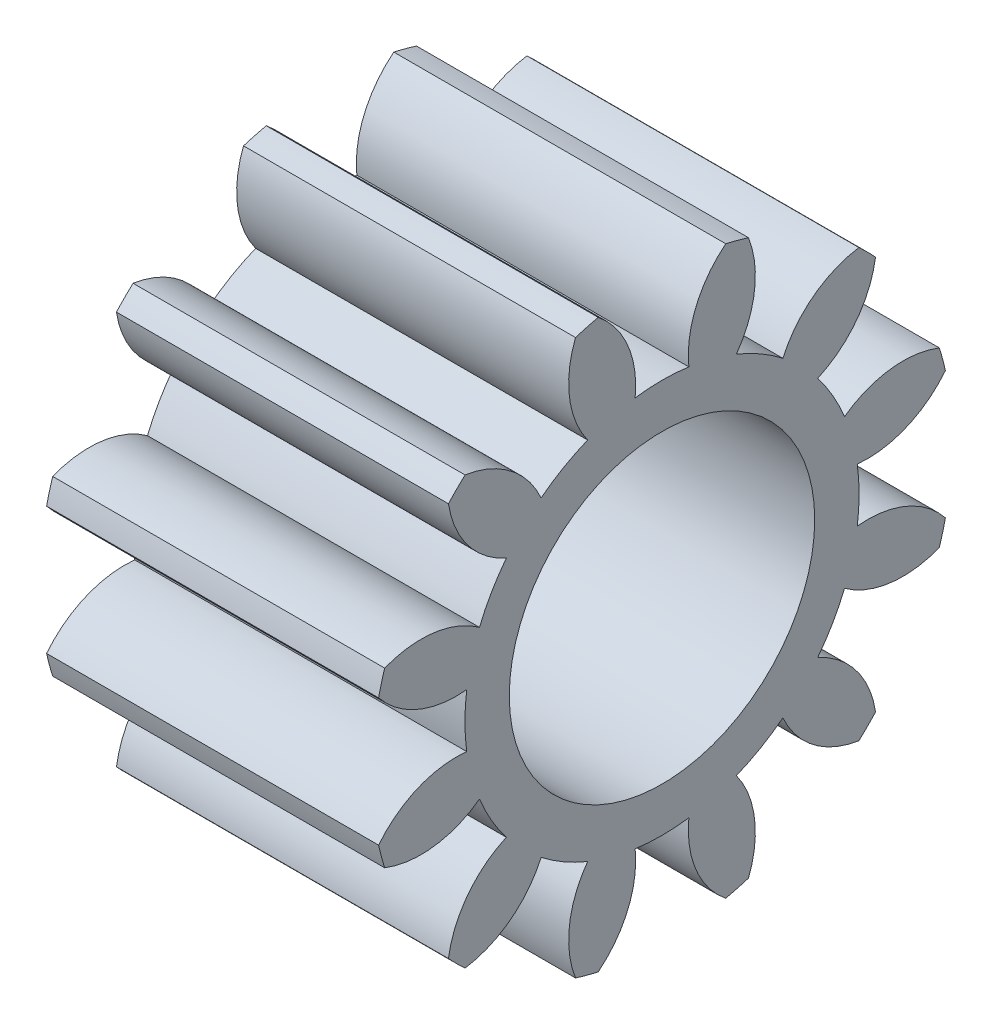
from build123d import *

# Parameters (mm, degrees)
BASPROSKE_W        = 12.7
BASPROSKE_H        = 11.1125
TOOTHCUT_DEPTH     = 21.205576272
TEETHCUTS_COUNT    = 12
TEETHCUTS_ANGLE    = 330
BORSKE_R           = 3.175
BORE_DEPTH         = 50.8000508
SKETCH2_R          = 5.842
CUT_EXTRUDE1_DEPTH = 20.908878764


with BuildPart() as part:
    # BasProSke → Base-Revolve (revolve)
    with BuildSketch(Plane(origin=(0, 0, 0), x_dir=(1, 0, 0), z_dir=(0, 1, 0)), mode=Mode.PRIVATE) as base_revolve_sk:
        with Locations((6.35, 5.55625)):
            Rectangle(BASPROSKE_W, BASPROSKE_H)
    revolve(base_revolve_sk.sketch.rotate(Axis((-10, 0, 0), (1, 0, 0)), 180), axis=Axis((-10, 0, 0), (1, 0, 0)))

    # TooCutSke → ToothCut (cut, through all)
    with BuildSketch(Plane(origin=(0, 0, 0), x_dir=(0, 0, -1), z_dir=(1, 0, 0))):
        with BuildLine():
            ThreePointArc((1.026937745, 7.469087808), (0, 7.539355), (-1.026937745, 7.469087808))
            ThreePointArc((-1.026937745, 7.469087808), (-1.30857978, 9.35080814), (-2.465050847, 10.861691431))
            ThreePointArc((-2.465050847, 10.861691431), (0, 11.1379), (2.465050847, 10.861691431))
            ThreePointArc((2.465050847, 10.861691431), (1.30857978, 9.35080814), (1.026937745, 7.469087808))
        make_face()
    toothcut = extrude(amount=TOOTHCUT_DEPTH, mode=Mode.SUBTRACT)

    # TeethCuts: ToothCut ×12 about axis
    teethcuts_axis = Axis((-10, 0, 0), (1, 0, 0))
    for i in range(1, TEETHCUTS_COUNT):
        add(toothcut.rotate(teethcuts_axis, i * TEETHCUTS_ANGLE / (TEETHCUTS_COUNT - 1)), mode=Mode.SUBTRACT)

    # BorSke → Bore (cut, symmetric)
    with BuildSketch(Plane(origin=(0, 0, 0), x_dir=(0, 0, -1), z_dir=(1, 0, 0))):
        with Locations(Location((0, 0, 0), (0, 0, 180))):
            Circle(BORSKE_R)
    extrude(amount=BORE_DEPTH, both=True, mode=Mode.SUBTRACT)

    # Sketch2 → Cut-Extrude1 (cut, through all)
    with BuildSketch(Plane(origin=(12.7, 0, 0), x_dir=(0, 0, -1), z_dir=(1, 0, 0))):
        Circle(SKETCH2_R)
    extrude(amount=-CUT_EXTRUDE1_DEPTH, mode=Mode.SUBTRACT)


solid = part.part
